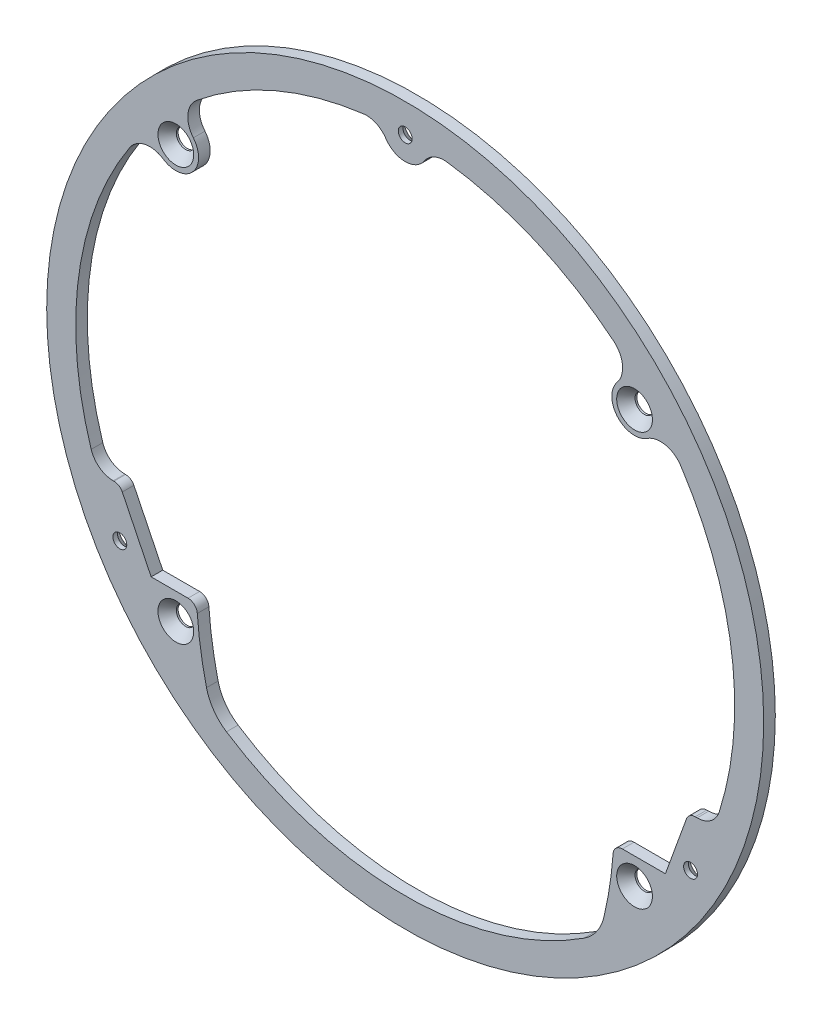
from build123d import *

# Parameters (mm, degrees)
SKETCH1_R                 = 98.1075
SKETCH1_R_2               = 90.17
BOSS_EXTRUDE1_DEPTH       = 3.175
BOSS_EXTRUDE2_START       = -3.175
BOSS_EXTRUDE2_DEPTH       = 3.175
BOSS_EXTRUDE3_START       = -3.175
BOSS_EXTRUDE3_DEPTH       = 3.175
BOSS_EXTRUDE5_DEPTH       = 3.175
MIRROR2_START             = -3.175
MIRROR2_COPY_1_DEPTH      = 3.175
CIRPATTERN1_COUNT         = 3
FILLET1_R                 = 3.175
BOSS_EXTRUDE6_START       = -3.175
BOSS_EXTRUDE6_DEPTH       = 3.175
FILLET2_R                 = 6.35
F_6_CLEARANCE_HOLE1_D     = 3.7973
F_6_CLEARANCE_HOLE1_DEPTH = 6.35
F_6_CLEARANCE_HOLE1_TIP   = 1.140824014
CUT_EXTRUDE1_DEPTH        = 139.781280213
FILLET3_R                 = 2.54


with BuildPart() as part:
    # Sketch1 → Boss-Extrude1 (new body)
    with BuildSketch(Plane.XY):
        Circle(SKETCH1_R)
        Circle(SKETCH1_R_2, mode=Mode.SUBTRACT)
    extrude(amount=BOSS_EXTRUDE1_DEPTH)

    # Sketch2 → Boss-Extrude2 (add)
    with BuildSketch(Plane.XY.offset(3.175).offset(BOSS_EXTRUDE2_START)):
        with BuildLine():
            ThreePointArc((-5.291472464, 86.659612676), (0, 83.82), (5.291472464, 86.659612676))
            ThreePointArc((5.291472464, 86.659612676), (7.940261692, 88.923194985), (11.38468318, 89.448409091))
            ThreePointArc((11.38468318, 89.448409091), (0, 90.17), (-11.38468318, 89.448409091))
            ThreePointArc((-11.38468318, 89.448409091), (-7.940261692, 88.923194985), (-5.291472464, 86.659612676))
        make_face()
    boss_extrude2 = extrude(amount=BOSS_EXTRUDE2_DEPTH)

    # Sketch9 → Boss-Extrude3 (add)
    with BuildSketch(Plane.XY.offset(3.175).offset(BOSS_EXTRUDE3_START)):
        with BuildLine():
            ThreePointArc((66.212341469, -51.332340799), (58.137705987, -52.347425597), (57.972211169, -60.483932635))
            ThreePointArc((57.972211169, -60.483932635), (59.462085873, -65.336411741), (57.068521986, -69.812697257))
            ThreePointArc((57.068521986, -69.812697257), (67.009368913, -60.335506775), (75.395540901, -49.458480691))
            ThreePointArc((75.395540901, -49.458480691), (71.1939725, -52.306831631), (66.212341469, -51.332340799))
        make_face()
    boss_extrude3 = extrude(amount=BOSS_EXTRUDE3_DEPTH)

    # Sketch11 → Boss-Extrude5 (add)
    with BuildSketch(Plane.XY):
        with BuildLine():
            ThreePointArc((-60.552516274, -19.396575562), (-63.5, -44.45), (-60.552516274, -69.503424438))
            ThreePointArc((-60.552516274, -69.503424438), (-57.572960629, -76.08635224), (-52.356101558, -81.086059404))
            ThreePointArc((-52.356101558, -81.086059404), (0, -96.52), (52.356101558, -81.086059404))
            ThreePointArc((52.356101558, -81.086059404), (57.572960629, -76.08635224), (60.552516274, -69.503424438))
            ThreePointArc((60.552516274, -69.503424438), (63.5, -44.45), (60.552516274, -19.396575562))
            ThreePointArc((60.552516274, -19.396575562), (57.572960629, -12.81364776), (52.356101558, -7.813940596))
            ThreePointArc((52.356101558, -7.813940596), (0, 7.62), (-52.356101558, -7.813940596))
            ThreePointArc((-52.356101558, -7.813940596), (-57.572960629, -12.81364776), (-60.552516274, -19.396575562))
        make_face()
        with BuildLine():
            ThreePointArc((48.911621193, -13.148549768), (0, 1.27), (-48.911621193, -13.148549768))
            ThreePointArc((-48.911621193, -13.148549768), (-52.38952724, -16.481687877), (-54.37589767, -20.870306412))
            ThreePointArc((-54.37589767, -20.870306412), (-57.15, -44.45), (-54.37589767, -68.029693588))
            ThreePointArc((-54.37589767, -68.029693588), (-52.38952724, -72.418312123), (-48.911621193, -75.751450232))
            ThreePointArc((-48.911621193, -75.751450232), (0, -90.17), (48.911621193, -75.751450232))
            ThreePointArc((48.911621193, -75.751450232), (52.38952724, -72.418312123), (54.37589767, -68.029693588))
            ThreePointArc((54.37589767, -68.029693588), (57.15, -44.45), (54.37589767, -20.870306412))
            ThreePointArc((54.37589767, -20.870306412), (52.38952724, -16.481687877), (48.911621193, -13.148549768))
        make_face(mode=Mode.SUBTRACT)
    extrude(amount=BOSS_EXTRUDE5_DEPTH)

    # Sketch3 → CSK for #10 Flat Head Machine Screw1 (revolve, cut)
    with BuildSketch(Plane(origin=(62.762296236, -56.51142536, 3.175), x_dir=(0, -1, 0), z_dir=(1, 0, 0))):
        Polygon((0, 0), (0, 3.175), (2.5527, 3.175), (2.5527, 2.688180894), (4.8895, 0), align=None)
    csk_for_10_flat_head_machine_screw1 = revolve(axis=Axis((62.762296236, -56.51142536, 9.525), (0, 0, -1)), mode=Mode.SUBTRACT)

    # Sketch7 → CSK for #6 Flat Head Machine Screw1 (revolve, cut)
    with BuildSketch(Plane(origin=(0, 90.17, 0), x_dir=(0, 1, 0), z_dir=(1, 0, 0))):
        Polygon((0, 0), (0, 3.175), (1.89865, 3.175), (1.89865, 1.891953401), (3.5433, 0), align=None)
    csk_for_6_flat_head_machine_screw1 = revolve(axis=Axis((0, 90.17, -6.35), (0, 0, 1)), mode=Mode.SUBTRACT)

    # Mirror1: Boss-Extrude3, CSK for #10 Flat Head Machine Screw1 across plane
    add(boss_extrude3.mirror(Plane.ZX))
    add(csk_for_10_flat_head_machine_screw1.mirror(Plane.ZX), mode=Mode.SUBTRACT)

    # Mirror2: Boss-Extrude3, CSK for #10 Flat Head Machine Screw1 across plane
    add(boss_extrude3.mirror(Plane(origin=(0, 0, 0), x_dir=(0, 0, 1), z_dir=(1, 0, 0))))
    add(csk_for_10_flat_head_machine_screw1.mirror(Plane(origin=(0, 0, 0), x_dir=(0, 0, 1), z_dir=(1, 0, 0))), mode=Mode.SUBTRACT)

    # Mirror2 copy 1 sketch → Mirror2 copy 1 (add)
    with BuildSketch(Plane(origin=(0, 0, 3.175), x_dir=(-1, 0, 0), z_dir=(0, 0, 1)).offset(MIRROR2_START)):
        with BuildLine():
            ThreePointArc((66.212341469, -51.332340799), (58.137705987, -52.347425597), (57.972211169, -60.483932635))
            ThreePointArc((57.972211169, -60.483932635), (59.462085873, -65.336411741), (57.068521986, -69.812697257))
            ThreePointArc((57.068521986, -69.812697257), (67.009368913, -60.335506775), (75.395540901, -49.458480691))
            ThreePointArc((75.395540901, -49.458480691), (71.1939725, -52.306831631), (66.212341469, -51.332340799))
        make_face()
    extrude(amount=MIRROR2_COPY_1_DEPTH)

    # Mirror2 copy 2 sketch → Mirror2 copy 2 (revolve, cut)
    with BuildSketch(Plane(origin=(-62.762296236, 56.51142536, 3.175), x_dir=(0, 1, 0), z_dir=(-1, 0, 0))):
        Polygon((0, 0), (0, 3.175), (2.5527, 3.175), (2.5527, 2.688180894), (4.8895, 0), align=None)
    revolve(axis=Axis((-62.762296236, 56.51142536, 9.525), (0, 0, -1)), mode=Mode.SUBTRACT)

    # CirPattern1: Boss-Extrude2, CSK for #6 Flat Head Machine Screw1 ×3 about axis
    cirpattern1_axis = Axis((0, 0, 0), (0, 0, 1))
    add([boss_extrude2.rotate(cirpattern1_axis, i * 360 / CIRPATTERN1_COUNT) for i in range(1, CIRPATTERN1_COUNT)])
    add([csk_for_6_flat_head_machine_screw1.rotate(cirpattern1_axis, i * 360 / CIRPATTERN1_COUNT) for i in range(1, CIRPATTERN1_COUNT)], mode=Mode.SUBTRACT)

    # Fillet1
    fillet1_edges = [part.edges().sort_by_distance(p)[0] for p in [
        (-63.34053847, -50.315348785, 1.5875),
        (63.34053847, -50.315348785, 1.5875),
    ]]
    fillet(fillet1_edges, radius=FILLET1_R)

    # Sketch13 → Boss-Extrude6 (add)
    with BuildSketch(Plane.XY.offset(3.175).offset(BOSS_EXTRUDE6_START)):
        with BuildLine():
            Line((-62.750338152, -31.75), (-84.395298447, -31.75))
            ThreePointArc((-84.395298447, -31.75), (-83.790591931, -33.31314461), (-83.156936191, -34.864779698))
            ThreePointArc((-83.156936191, -34.864779698), (-80.979876688, -37.585129154), (-77.695162292, -38.747256761))
            ThreePointArc((-77.695162292, -38.747256761), (-72.590249345, -41.91), (-72.403689828, -47.912355915))
            ThreePointArc((-72.403689828, -47.912355915), (-72.988143244, -49.736636134), (-73.00196491, -51.652202127))
            ThreePointArc((-73.00196491, -51.652202127), (-69.562842084, -52.432853205), (-66.212341469, -51.332340799))
            ThreePointArc((-66.212341469, -51.332340799), (-65.774776399, -51.066180438), (-65.316806621, -50.836902852))
            ThreePointArc((-65.316806621, -50.836902852), (-63.927038857, -49.623372793), (-63.44669601, -47.841974356))
            ThreePointArc((-63.44669601, -47.841974356), (-63.39906785, -39.78298126), (-62.750338152, -31.75))
        make_face()
        with BuildLine():
            Line((84.395298447, -31.75), (62.750338152, -31.75))
            ThreePointArc((62.750338152, -31.75), (63.39906785, -39.78298126), (63.44669601, -47.841974356))
            ThreePointArc((63.44669601, -47.841974356), (63.927038857, -49.623372793), (65.316806621, -50.836902852))
            ThreePointArc((65.316806621, -50.836902852), (65.774776399, -51.066180438), (66.212341469, -51.332340799))
            ThreePointArc((66.212341469, -51.332340799), (69.562842084, -52.432853205), (73.00196491, -51.652202127))
            ThreePointArc((73.00196491, -51.652202127), (72.988143244, -49.736636134), (72.403689828, -47.912355915))
            ThreePointArc((72.403689828, -47.912355915), (72.590249345, -41.91), (77.695162292, -38.747256761))
            ThreePointArc((77.695162292, -38.747256761), (80.979876688, -37.585129154), (83.156936191, -34.864779698))
            ThreePointArc((83.156936191, -34.864779698), (83.790591931, -33.31314461), (84.395298447, -31.75))
        make_face()
    extrude(amount=BOSS_EXTRUDE6_DEPTH)

    # Fillet2
    fillet2_edges = [part.edges().sort_by_distance(p)[0] for p in [
        (-62.750338152, -31.75, 1.5875),
        (-84.395298447, -31.75, 1.5875),
        (84.395298447, -31.75, 1.5875),
        (62.750338152, -31.75, 1.5875),
    ]]
    fillet(fillet2_edges, radius=FILLET2_R)

    # #6 Clearance Hole1
    with Locations(Plane.XY.offset(3.175)):
        with Locations((-66.675, -44.45), (66.675, -44.45)):
            Hole(F_6_CLEARANCE_HOLE1_D / 2, depth=F_6_CLEARANCE_HOLE1_DEPTH)
            with Locations((0, 0, -(F_6_CLEARANCE_HOLE1_DEPTH + F_6_CLEARANCE_HOLE1_TIP / 2))):  # 118° drill point
                Cone(0, F_6_CLEARANCE_HOLE1_D / 2, F_6_CLEARANCE_HOLE1_TIP, mode=Mode.SUBTRACT)

    # Sketch16 → Cut-Extrude1 (cut, through all)
    with BuildSketch(Plane.XY.offset(3.175)):
        Polygon((-79.573670406, -28.758087868), (-69.516837715, -49.335914757), (-54.97311044, -49.335914757), (71.200840815, -49.335914757), (78.661378441, -28.758087868), (74.931109628, 37.993907033), (-79.573670406, 37.993907033), align=None)
    extrude(amount=-CUT_EXTRUDE1_DEPTH, mode=Mode.SUBTRACT)

    # Fillet3
    fillet3_edges = [part.edges().sort_by_distance(p)[0] for p in [
        (77.576653938, -31.75, 1.5875),
        (-78.111457709, -31.75, 1.5875),
        (57.032450882, -49.335914757, 1.5875),
        (-57.032450882, -49.335914757, 1.5875),
    ]]
    fillet(fillet3_edges, radius=FILLET3_R)


solid = part.part
